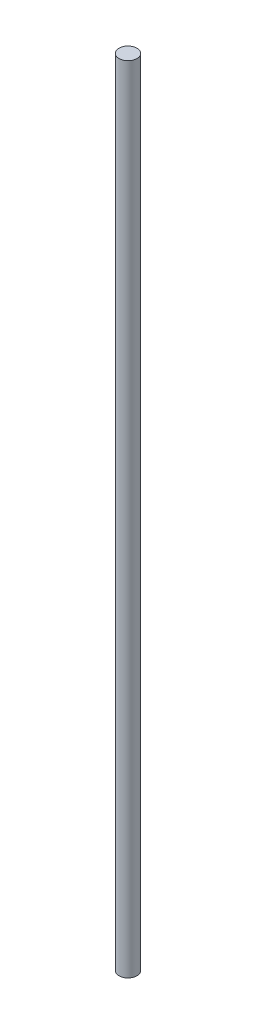
from build123d import *

# Parameters (mm, degrees)
CROQUIS1_R              = 4.25
SALIENTE_EXTRUIR1_DEPTH = 375


with BuildPart() as part:
    # Croquis1 → Saliente-Extruir1 (new body)
    with BuildSketch(Plane(origin=(0, 0, 0), x_dir=(1, 0, 0), z_dir=(0, 1, 0))):
        with Locations(Location((0, 0, 0), (0, 0, 270))):
            Circle(CROQUIS1_R)
    extrude(amount=SALIENTE_EXTRUIR1_DEPTH)


solid = part.part
